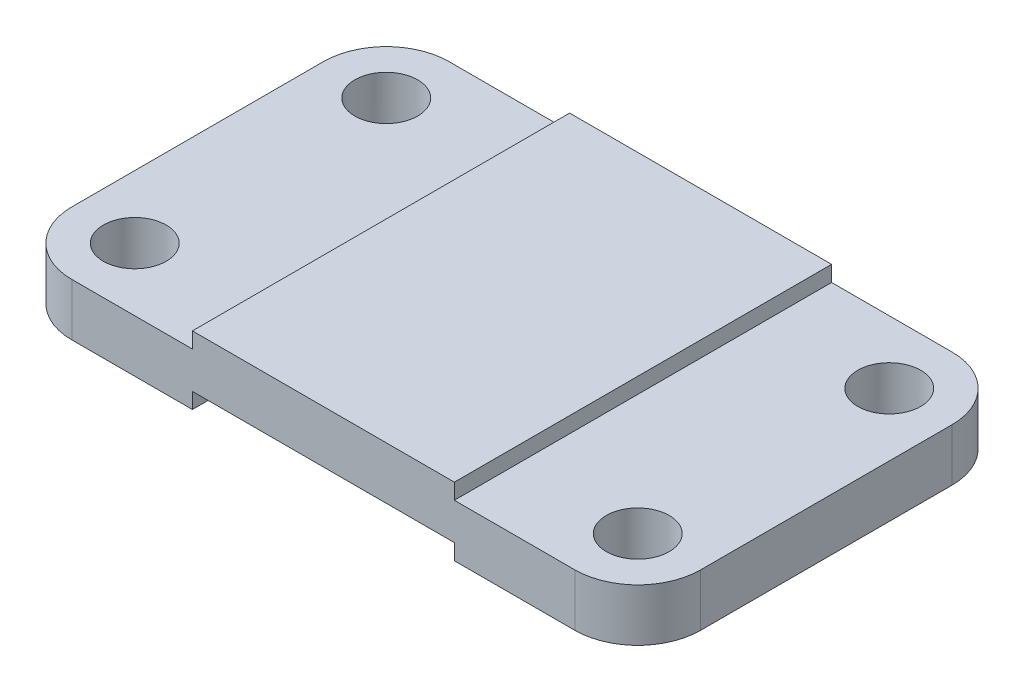
from build123d import *

# Parameters (mm, degrees)
BOSS_EXTRUDE1_DEPTH = 10
SKETCH2_W           = 50
SKETCH2_H           = 72
BOSS_EXTRUDE2_DEPTH = 3
SKETCH3_W           = 50
SKETCH3_H           = 72
CUT_EXTRUDE1_DEPTH  = 3
SKETCH4_R           = 6
CUT_EXTRUDE3_DEPTH  = 49


with BuildPart() as part:
    # Sketch1 → Boss-Extrude1 (new body)
    with BuildSketch(Plane(origin=(0, 0, 0), x_dir=(1, 0, 0), z_dir=(0, 1, 0))):
        with BuildLine():
            Line((-48, 36), (48, 36))
            ThreePointArc((48, 36), (56.485281374, 32.485281374), (60, 24))
            Line((60, 24), (60, -24))
            ThreePointArc((60, -24), (56.485281374, -32.485281374), (48, -36))
            Line((48, -36), (-48, -36))
            ThreePointArc((-48, -36), (-56.485281374, -32.485281374), (-60, -24))
            Line((-60, -24), (-60, 24))
            ThreePointArc((-60, 24), (-56.485281374, 32.485281374), (-48, 36))
        make_face()
    extrude(amount=BOSS_EXTRUDE1_DEPTH)

    # Sketch2 → Boss-Extrude2 (add)
    with BuildSketch(Plane(origin=(0, 10, 0), x_dir=(1, 0, 0), z_dir=(0, 1, 0))):
        Rectangle(SKETCH2_W, SKETCH2_H)
    extrude(amount=BOSS_EXTRUDE2_DEPTH)

    # Sketch3 → Cut-Extrude1 (cut)
    with BuildSketch(Plane.XZ):
        Rectangle(SKETCH3_W, SKETCH3_H)
    extrude(amount=-CUT_EXTRUDE1_DEPTH, mode=Mode.SUBTRACT)

    # Sketch4 → Cut-Extrude3 (cut)
    with BuildSketch(Plane(origin=(0, 10, 0), x_dir=(1, 0, 0), z_dir=(0, 1, 0))):
        with Locations(Location((48, 24, 0), (0, 0, 270))):
            Circle(SKETCH4_R)
        with Locations(Location((48, -24, 0), (0, 0, 270))):
            Circle(SKETCH4_R)
        with Locations(Location((-48, -24, 0), (0, 0, 270))):
            Circle(SKETCH4_R)
        with Locations(Location((-48, 24, 0), (0, 0, 270))):
            Circle(SKETCH4_R)
    extrude(amount=-CUT_EXTRUDE3_DEPTH, mode=Mode.SUBTRACT)


solid = part.part
